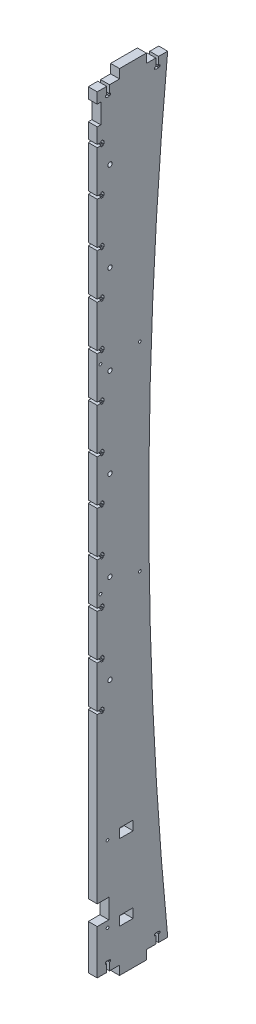
from build123d import *

# Parameters (mm, degrees)
DODANIE_WYCI_GNI_CIE1_DEPTH = 10
SZKIC1_W                    = 30
SZKIC1_H                    = 10.1
SZKIC1_W_2                  = 25
WYTNIJ_WYCI_GNI_CIE1_DEPTH  = 10
WYTNIJ_WYCI_GNI_CIE2_DEPTH  = 10
SZYK_LINIOWY1_COUNT         = 2
SZYK_LINIOWY1_PITCH         = 55
SZKIC5_R                    = 1.55
SZKIC5_W                    = 15.4
SZKIC5_H                    = 10.4
WYTNIJ_WYCI_GNI_CIE3_DEPTH  = 10
WYTNIJ_WYCI_GNI_CIE4_DEPTH  = 10
SZYK_LINIOWY2_COUNT         = 12
SZYK_LINIOWY2_PITCH         = 50
SZKIC8_W                    = 13
SZKIC8_H                    = 22
WYTNIJ_WYCI_GNI_CIE6_DEPTH  = 10
SZKIC9_W                    = 4
SZKIC9_H                    = 22
WYTNIJ_WYCI_GNI_CIE7_DEPTH  = 10
LUSTRO1_COPY_1_DEPTH        = 10
SZKIC13_R                   = 1.55
WYTNIJ_WYCI_GNI_CIE8_DEPTH  = 10
SZYK_LINIOWY4_COUNT         = 2
SZYK_LINIOWY4_PITCH         = 223
SZKIC14_R                   = 2.45
WYTNIJ_WYCI_GNI_CIE9_DEPTH  = 10
SZYK_LINIOWY5_COUNT         = 6
SZYK_LINIOWY5_PITCH         = 100


with BuildPart() as part:
    # Szkic11 → Dodanie-wyciągnięcie1 (new body)
    with BuildSketch(Plane.ZY.offset(-248.52281754)):
        with BuildLine():
            Line((-79.001367167, 0), (0, 0))
            Line((0, 0), (0, 880))
            Line((0, 880), (-78.955177412, 880))
            Line((-78.955177412, 880), (-78.955177412, 870))
            ThreePointArc((-78.955177412, 870), (-57.819766969, 439.998863597), (-79.001367167, 10))
            Line((-79.001367167, 10), (-79.001367167, 0))
        make_face()
    extrude(amount=DODANIE_WYCI_GNI_CIE1_DEPTH)

    # Szkic1 → Wytnij-wyciągnięcie1 (cut)
    with BuildSketch(Plane(origin=(248.52281754, 0, 0), x_dir=(0, 0, -1), z_dir=(1, 0, 0))):
        with Locations((70, 874.95)):
            Rectangle(SZKIC1_W, SZKIC1_H)
        with Locations((12.5, 874.95)):
            Rectangle(SZKIC1_W_2, SZKIC1_H)
    wytnij_wyci_gni_cie1 = extrude(amount=-WYTNIJ_WYCI_GNI_CIE1_DEPTH, mode=Mode.SUBTRACT)

    # Szkic2 → Wytnij-wyciągnięcie2 (cut)
    with BuildSketch(Plane(origin=(248.52281754, 0, 0), x_dir=(0, 0, -1), z_dir=(1, 0, 0))):
        Polygon((10.660920663, 869.9), (13.760920663, 869.9), (13.760920663, 861.4), (15.135920663, 861.4), (15.135920663, 859.4), (13.760920663, 859.4), (13.760920663, 858.9), (10.660920663, 858.9), (10.660920663, 859.4), (9.285920663, 859.4), (9.285920663, 861.4), (10.660920663, 861.4), align=None)
    wytnij_wyci_gni_cie2 = extrude(amount=-WYTNIJ_WYCI_GNI_CIE2_DEPTH, mode=Mode.SUBTRACT)

    # Szyk liniowy1: Wytnij-wyciągnięcie2 ×2
    with Locations(*[(0, 0, -i * SZYK_LINIOWY1_PITCH) for i in range(1, SZYK_LINIOWY1_COUNT)]):
        add(wytnij_wyci_gni_cie2, mode=Mode.SUBTRACT)

    # Szkic5 → Wytnij-wyciągnięcie3 (cut)
    with BuildSketch(Plane.ZY.offset(-248.52281754)):
        with Locations((-11.55, 53)):
            Circle(SZKIC5_R)
        with Locations((-11.55, 138)):
            Circle(SZKIC5_R)
        with Locations((-32.5, 138)):
            Rectangle(SZKIC5_W, SZKIC5_H)
        with Locations((-32.5, 53)):
            Rectangle(SZKIC5_W, SZKIC5_H)
    extrude(amount=WYTNIJ_WYCI_GNI_CIE3_DEPTH, mode=Mode.SUBTRACT)

    # Szkic6 → Wytnij-wyciągnięcie4 (cut)
    with BuildSketch(Plane(origin=(248.52281754, 0, 0), x_dir=(0, 0, -1), z_dir=(1, 0, 0))):
        Polygon((0, 815.69), (4.5, 815.69), (4.5, 814.315), (6.5, 814.315), (6.5, 815.69), (7.5, 815.69), (7.5, 818.79), (6.5, 818.79), (6.5, 820.165), (4.5, 820.165), (4.5, 818.79), (0, 818.79), align=None)
    wytnij_wyci_gni_cie4 = extrude(amount=-WYTNIJ_WYCI_GNI_CIE4_DEPTH, mode=Mode.SUBTRACT)

    # Szyk liniowy2: Wytnij-wyciągnięcie4 ×12
    with Locations(*[(0, -i * SZYK_LINIOWY2_PITCH, 0) for i in range(1, SZYK_LINIOWY2_COUNT)]):
        add(wytnij_wyci_gni_cie4, mode=Mode.SUBTRACT)

    # Szkic8 → Wytnij-wyciągnięcie6 (cut)
    with BuildSketch(Plane(origin=(248.52281754, 0, 0), x_dir=(0, 0, -1), z_dir=(1, 0, 0))):
        with Locations((6.5, 71)):
            Rectangle(SZKIC8_W, SZKIC8_H)
    extrude(amount=-WYTNIJ_WYCI_GNI_CIE6_DEPTH, mode=Mode.SUBTRACT)

    # Szkic9 → Wytnij-wyciągnięcie7 (cut)
    with BuildSketch(Plane(origin=(248.52281754, 0, 0), x_dir=(0, 0, -1), z_dir=(1, 0, 0))):
        with Locations((2, 846.9)):
            Rectangle(SZKIC9_W, SZKIC9_H)
    extrude(amount=-WYTNIJ_WYCI_GNI_CIE7_DEPTH, mode=Mode.SUBTRACT)

    # Lustro1: Wytnij-wyciągnięcie1, Wytnij-wyciągnięcie2 across plane
    add(wytnij_wyci_gni_cie1.mirror(Plane.ZX.offset(440)), mode=Mode.SUBTRACT)
    add(wytnij_wyci_gni_cie2.mirror(Plane.ZX.offset(440)), mode=Mode.SUBTRACT)

    # Lustro1 copy 1 sketch → Lustro1 copy 1 (cut)
    with BuildSketch(Plane(origin=(248.52281754, 880, -55), x_dir=(0, 0, -1), z_dir=(1, 0, 0))):
        Polygon((10.660920663, -869.9), (13.760920663, -869.9), (13.760920663, -861.4), (15.135920663, -861.4), (15.135920663, -859.4), (13.760920663, -859.4), (13.760920663, -858.9), (10.660920663, -858.9), (10.660920663, -859.4), (9.285920663, -859.4), (9.285920663, -861.4), (10.660920663, -861.4), align=None)
    extrude(amount=-LUSTRO1_COPY_1_DEPTH, mode=Mode.SUBTRACT)

    # Szkic13 → Wytnij-wyciągnięcie8 (cut)
    with BuildSketch(Plane(origin=(248.52281754, 0, 0), x_dir=(0, 0, -1), z_dir=(1, 0, 0))):
        with Locations((3.7, 603.736985413)):
            Circle(SZKIC13_R)
        with Locations((47.7, 603.736985413)):
            Circle(SZKIC13_R)
    wytnij_wyci_gni_cie8 = extrude(amount=-WYTNIJ_WYCI_GNI_CIE8_DEPTH, mode=Mode.SUBTRACT)

    # Szyk liniowy4: Wytnij-wyciągnięcie8 ×2
    with Locations(*[(0, -i * SZYK_LINIOWY4_PITCH, 0) for i in range(1, SZYK_LINIOWY4_COUNT)]):
        add(wytnij_wyci_gni_cie8, mode=Mode.SUBTRACT)

    # Szkic14 → Wytnij-wyciągnięcie9 (cut)
    with BuildSketch(Plane(origin=(248.52281754, 0, 0), x_dir=(0, 0, -1), z_dir=(1, 0, 0))):
        with Locations((14.31069395, 792.236985413)):
            Circle(SZKIC14_R)
    wytnij_wyci_gni_cie9 = extrude(amount=-WYTNIJ_WYCI_GNI_CIE9_DEPTH, mode=Mode.SUBTRACT)

    # Szyk liniowy5: Wytnij-wyciągnięcie9 ×6
    with Locations(*[(0, -i * SZYK_LINIOWY5_PITCH, 0) for i in range(1, SZYK_LINIOWY5_COUNT)]):
        add(wytnij_wyci_gni_cie9, mode=Mode.SUBTRACT)


solid = part.part
